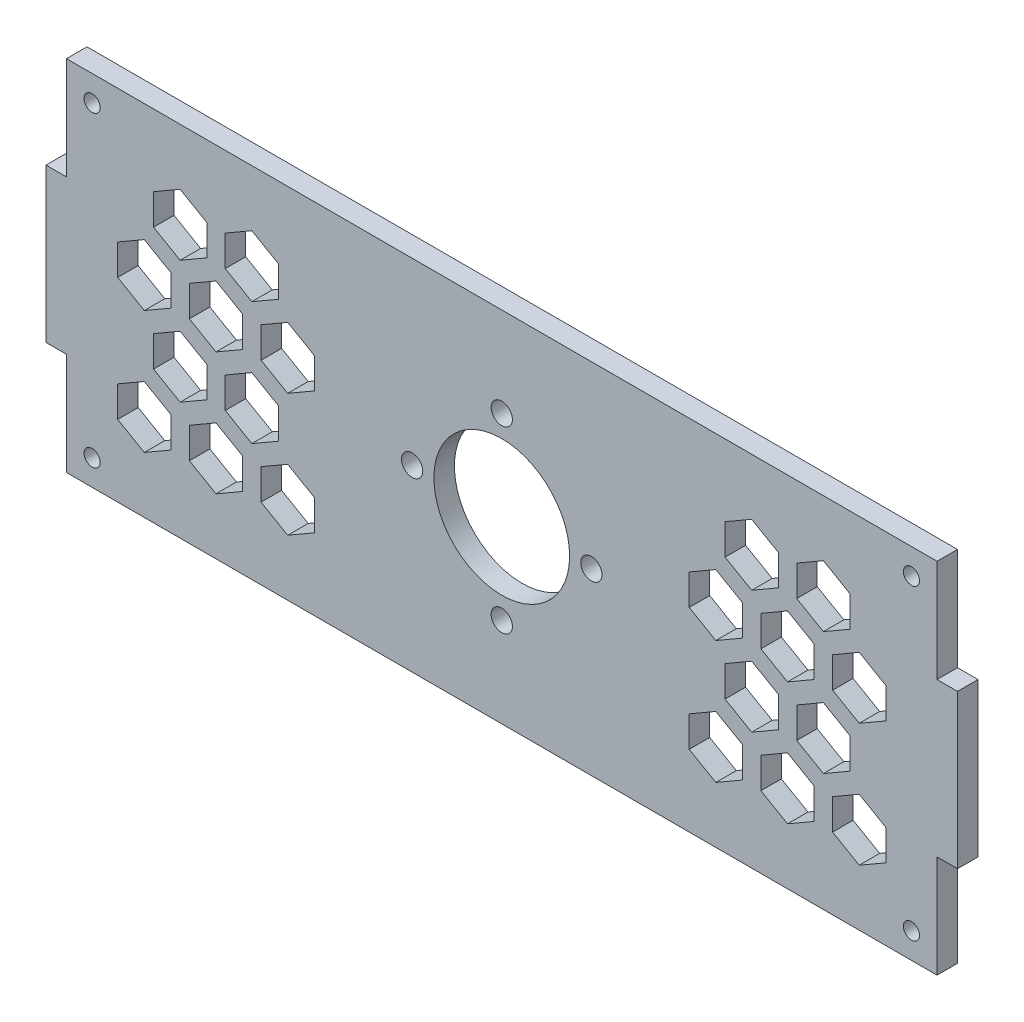
from build123d import *

# Parameters (mm, degrees)
SKETCH_1_W          = 178
SKETCH_1_H          = 70
EXTRUDE_1_DEPTH     = 4
SKETCH_2_R          = 13.25
SKETCH_2_R_2        = 2.075
SKETCH_2_R_3        = 1.575
SKETCH_2_W          = 4
SKETCH_2_H          = 20
CUT_EXTRUDE_1_DEPTH = 192.311264697


with BuildPart() as part:
    # 草图1 → 凸台-拉伸1 (new body)
    with BuildSketch(Plane.XY):
        with Locations((89, -35)):
            Rectangle(SKETCH_1_W, SKETCH_1_H)
    extrude(amount=EXTRUDE_1_DEPTH)

    # 草图2 → 切除-拉伸1 (cut, through all)
    with BuildSketch(Plane.XY.offset(4)):
        with Locations((89, -35)):
            Circle(SKETCH_2_R)
        with Locations((89, -17.5)):
            Circle(SKETCH_2_R_2)
        with Locations((106.5, -35)):
            Circle(SKETCH_2_R_2)
        with Locations((89, -52.5)):
            Circle(SKETCH_2_R_2)
        with Locations((71.5, -35)):
            Circle(SKETCH_2_R_2)
        with Locations((9, -5)):
            Circle(SKETCH_2_R_3)
        with Locations(Location((9, -65, 0), (0, 0, 180))):
            Circle(SKETCH_2_R_3)
        with Locations((169, -65)):
            Circle(SKETCH_2_R_3)
        with Locations(Location((169, -5, 0), (0, 0, 180))):
            Circle(SKETCH_2_R_3)
        Polygon((40.196152423, -11), (35, -14), (35, -20), (40.196152423, -23), (45.392304845, -20), (45.392304845, -14), align=None)
        with Locations((2, -10)):
            Rectangle(SKETCH_2_W, SKETCH_2_H)
        with Locations((176, -10)):
            Rectangle(SKETCH_2_W, SKETCH_2_H)
        with Locations((176, -60)):
            Rectangle(SKETCH_2_W, SKETCH_2_H)
        with Locations((2, -60)):
            Rectangle(SKETCH_2_W, SKETCH_2_H)
        Polygon((26.196152423, -23), (31.392304845, -20), (31.392304845, -14), (26.196152423, -11), (21, -14), (21, -20), align=None)
        Polygon((33.196152423, -35), (38.392304845, -32), (38.392304845, -26), (33.196152423, -23), (28, -26), (28, -32), align=None)
        Polygon((47.196152423, -23), (42, -26), (42, -32), (47.196152423, -35), (52.392304845, -32), (52.392304845, -26), align=None)
        Polygon((14, -26), (19.196152423, -23), (24.392304845, -26), (24.392304845, -32), (19.196152423, -35), (14, -32), align=None)
        Polygon((35, -44), (35, -38), (40.196152423, -35), (45.392304845, -38), (45.392304845, -44), (40.196152423, -47), align=None)
        Polygon((21, -38), (26.196152423, -35), (31.392304845, -38), (31.392304845, -44), (26.196152423, -47), (21, -44), align=None)
        Polygon((14, -50), (14, -56), (19.196152423, -59), (24.392304845, -56), (24.392304845, -50), (19.196152423, -47), align=None)
        Polygon((42, -56), (42, -50), (47.196152423, -47), (52.392304845, -50), (52.392304845, -56), (47.196152423, -59), align=None)
        Polygon((28, -50), (33.196152423, -47), (38.392304845, -50), (38.392304845, -56), (33.196152423, -59), (28, -56), align=None)
        Polygon((144.803847577, -47), (139.607695155, -50), (139.607695155, -56), (144.803847577, -59), (150, -56), (150, -50), align=None)
        Polygon((130.803847577, -59), (136, -56), (136, -50), (130.803847577, -47), (125.607695155, -50), (125.607695155, -56), align=None)
        Polygon((164, -56), (158.803847577, -59), (153.607695155, -56), (153.607695155, -50), (158.803847577, -47), (164, -50), align=None)
        Polygon((137.803847577, -47), (143, -44), (143, -38), (137.803847577, -35), (132.607695155, -38), (132.607695155, -44), align=None)
        Polygon((151.803847577, -35), (146.607695155, -38), (146.607695155, -44), (151.803847577, -47), (157, -44), (157, -38), align=None)
        Polygon((164, -32), (164, -26), (158.803847577, -23), (153.607695155, -26), (153.607695155, -32), (158.803847577, -35), align=None)
        Polygon((136, -26), (136, -32), (130.803847577, -35), (125.607695155, -32), (125.607695155, -26), (130.803847577, -23), align=None)
        Polygon((150, -32), (144.803847577, -35), (139.607695155, -32), (139.607695155, -26), (144.803847577, -23), (150, -26), align=None)
        Polygon((143, -14), (143, -20), (137.803847577, -23), (132.607695155, -20), (132.607695155, -14), (137.803847577, -11), align=None)
        Polygon((157, -20), (151.803847577, -23), (146.607695155, -20), (146.607695155, -14), (151.803847577, -11), (157, -14), align=None)
    extrude(amount=-CUT_EXTRUDE_1_DEPTH, mode=Mode.SUBTRACT)


solid = part.part
